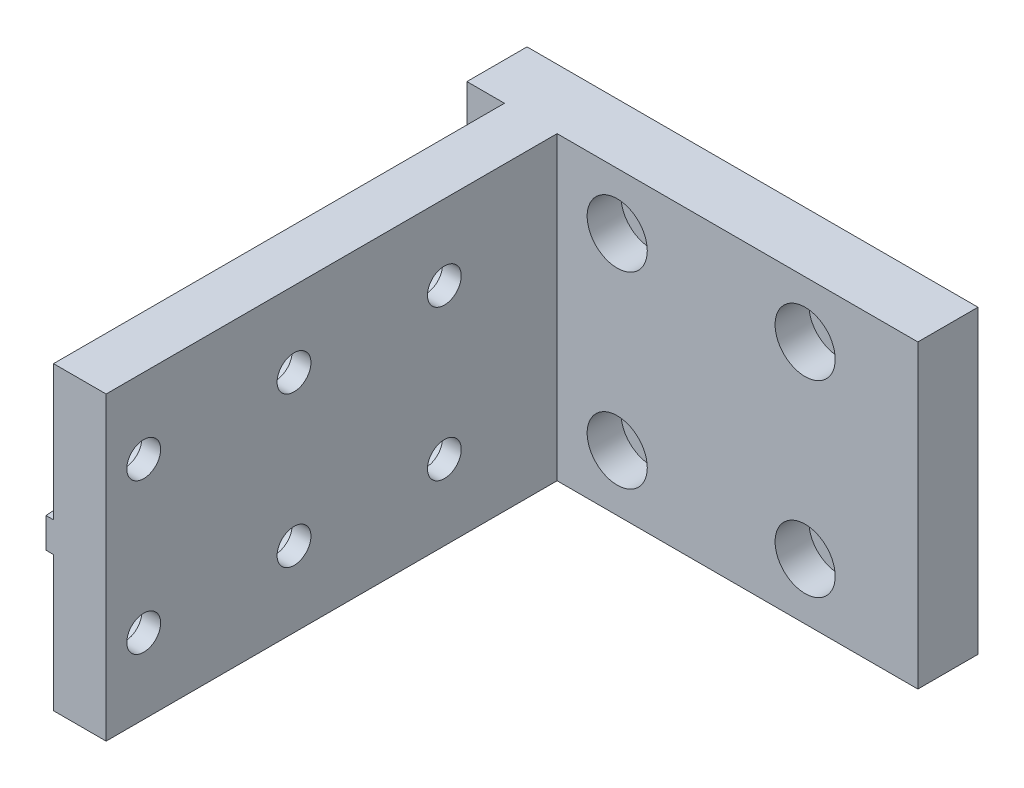
from build123d import *

# Parameters (mm, degrees)
SKETCH_1_W             = 60
SKETCH_1_H             = 40
EXTRUDE_2_DEPTH        = 8
SKETCH_3_R             = 2.25
CUT_EXTRUDE_1_DEPTH    = 8
SKETCH_4_R             = 4
CUT_EXTRUDE_2_DEPTH    = 4.5
SKETCH_5_W             = 7
SKETCH_5_H             = 40
EXTRUDE_3_DEPTH        = 60
CUT_EXTRUDE_3_REACH    = 91.716
SKETCH_6_R             = 2.25
SKETCH_7_R             = 4
CUT_EXTRUDE_4_DEPTH    = 4.5
PATTERN_LINEAR_1_COUNT = 3
PATTERN_LINEAR_1_PITCH = 20


with BuildPart() as part:
    # 草图1 → 凸台-拉伸2 (new body)
    with BuildSketch(Plane.XY):
        Rectangle(SKETCH_1_W, SKETCH_1_H)
    extrude(amount=EXTRUDE_2_DEPTH)

    # 草图3 → 切除-拉伸1 (cut)
    with BuildSketch(Plane.XY.offset(8)):
        with Locations((15, 12.5)):
            Circle(SKETCH_3_R)
        with Locations((15, -12.5)):
            Circle(SKETCH_3_R)
        with Locations((-10, 12.5)):
            Circle(SKETCH_3_R)
        with Locations((-10, -12.5)):
            Circle(SKETCH_3_R)
    extrude(amount=-CUT_EXTRUDE_1_DEPTH, mode=Mode.SUBTRACT)

    # 草图4 → 切除-拉伸2 (cut)
    with BuildSketch(Plane.XY.offset(8)):
        with Locations((15, 12.5)):
            Circle(SKETCH_4_R)
        with Locations((15, -12.5)):
            Circle(SKETCH_4_R)
        with Locations((-10, 12.5)):
            Circle(SKETCH_4_R)
        with Locations((-10, -12.5)):
            Circle(SKETCH_4_R)
    extrude(amount=-CUT_EXTRUDE_2_DEPTH, mode=Mode.SUBTRACT)

    # 草图5 → 凸台-拉伸3 (add)
    with BuildSketch(Plane.XY.offset(8)):
        with Locations((-21.5, 0)):
            Rectangle(SKETCH_5_W, SKETCH_5_H)
    extrude(amount=EXTRUDE_3_DEPTH)

    # 草图6 → 切除-拉伸3 (cut, up to next)
    with BuildSketch(Plane.ZY.offset(25), mode=Mode.PRIVATE) as cut_extrude_3_sk1:
        with Locations((63, 10)):
            Circle(SKETCH_6_R)
    cut_extrude_3_tool1 = extrude(cut_extrude_3_sk1.sketch, amount=-CUT_EXTRUDE_3_REACH, mode=Mode.PRIVATE) & part.part
    # 草图6 → 切除-拉伸3 (cut, up to next)
    with BuildSketch(Plane.ZY.offset(25), mode=Mode.PRIVATE) as cut_extrude_3_sk2:
        with Locations((63, -10)):
            Circle(SKETCH_6_R)
    cut_extrude_3_tool2 = extrude(cut_extrude_3_sk2.sketch, amount=-CUT_EXTRUDE_3_REACH, mode=Mode.PRIVATE) & part.part
    cut_extrude_3_1 = cut_extrude_3_tool1.solids().sort_by_distance((-25, 10, 63))[0]
    add(cut_extrude_3_1, mode=Mode.SUBTRACT)
    cut_extrude_3_2 = cut_extrude_3_tool2.solids().sort_by_distance((-25, -10, 63))[0]
    add(cut_extrude_3_2, mode=Mode.SUBTRACT)
    cut_extrude_3 = cut_extrude_3_1 + cut_extrude_3_2  # 切除-拉伸3 as one shape, for the pattern or mirror that repeats it

    # 草图7 → 切除-拉伸4 (cut)
    with BuildSketch(Plane.ZY.offset(25)):
        with Locations((63, 10)):
            Circle(SKETCH_7_R)
        with Locations((63, -10)):
            Circle(SKETCH_7_R)
    cut_extrude_4 = extrude(amount=-CUT_EXTRUDE_4_DEPTH, mode=Mode.SUBTRACT)

    # 阵列(线性)1: 切除-拉伸3, 切除-拉伸4 ×3
    with Locations(*[(0, 0, -i * PATTERN_LINEAR_1_PITCH) for i in range(1, PATTERN_LINEAR_1_COUNT)]):
        add(cut_extrude_3, mode=Mode.SUBTRACT)
        add(cut_extrude_4, mode=Mode.SUBTRACT)

    # 草图8 → 放样2 section 0
    with BuildSketch(Plane.XY.offset(8)):
        with BuildLine():
            Line((-30, 2), (-30, -2))
            Line((-30, -2), (-25, -2))
            Line((-25, -2), (-25, 2))
            Line((-25, 2), (-30, 2))
        make_face()
    # 草图9 → 放样2 section 1
    with BuildSketch(Plane.XY.offset(68)):
        with BuildLine():
            Line((-25, 2), (-26, 2))
            Line((-26, 2), (-26, -2))
            Line((-26, -2), (-25, -2))
            Line((-25, -2), (-25, 2))
        make_face()
    loft()


solid = part.part
